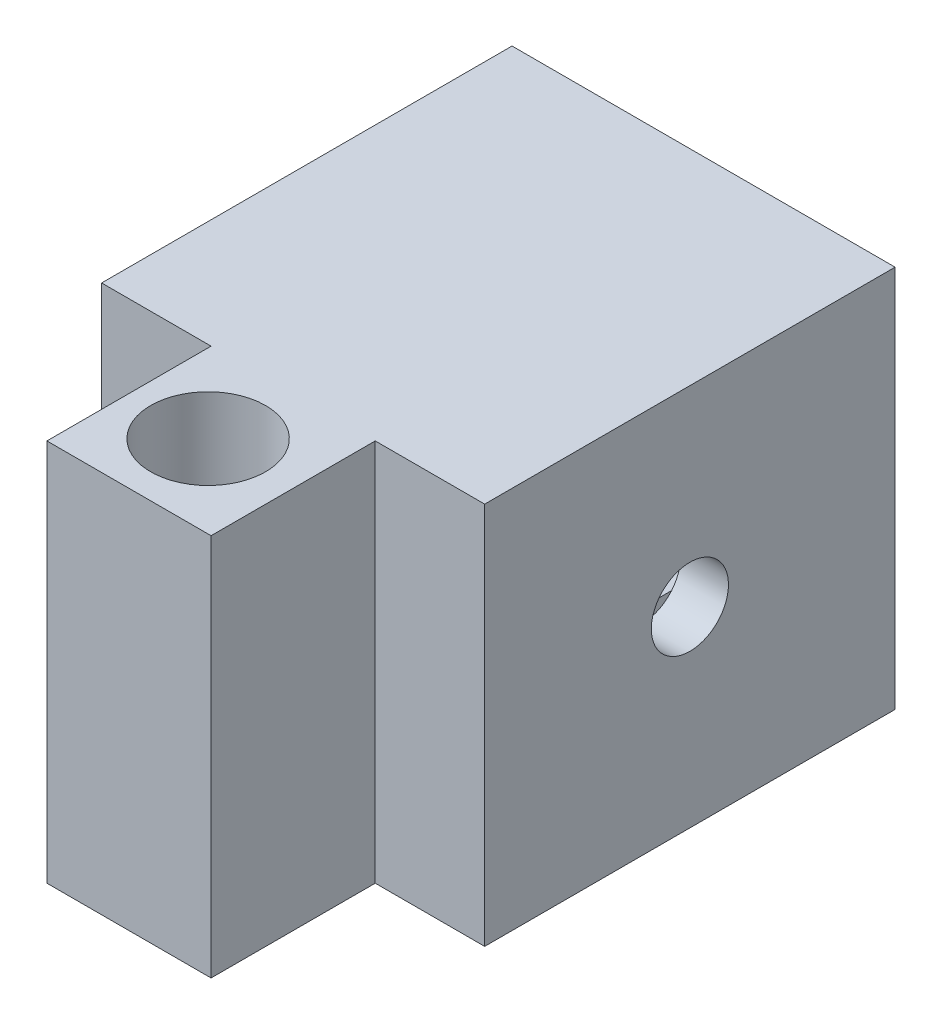
from build123d import *

# Parameters (mm, degrees)
EXTRUDE_2_DEPTH     = 30
EXTRUDE_2_2_DEPTH   = 30
EXTRUDE_3_DEPTH     = 5
SKETCH_2_5_W        = 28
SKETCH_2_5_H        = 28
EXTRUDE_4_DEPTH     = 30
SKETCH_5_R          = 2.82
CUT_EXTRUDE_1_DEPTH = 44.358966777
SKETCH_6_W          = 12
SKETCH_6_H          = 28
EXTRUDE_7_DEPTH     = 12
SKETCH_9_R          = 4.2
CUT_EXTRUDE_3_DEPTH = 44.358966777


with BuildPart() as part:
    # Эскиз2 → Бобышка-Вытянуть2 (new body)
    with BuildSketch(Plane.XY):
        Polygon((2.906720935, 8.8), (2.906720935, 10.5), (-2.993279065, 10.5), (-2.993279065, 8.8), (-4.495247842, 8.8), (-4.495247842, 7.799871607), (4.505554414, 7.799871607), (4.505554414, 8.8), align=None)
    extrude(amount=-EXTRUDE_2_DEPTH)



with BuildPart() as body_2:
    # Эскиз2 → Extrude 2 2 (new body)
    with BuildSketch(Plane.XY):
        Polygon((-2.993279065, -10.5), (2.906720935, -10.5), (2.906720935, -8.8), (4.505554414, -8.8), (4.505554414, -7.799871607), (-4.495247842, -7.799871607), (-4.495247842, -8.8), (-2.993279065, -8.8), align=None)
    extrude(amount=-EXTRUDE_2_2_DEPTH)


with BuildPart() as part_1:
    add(part.part)

    add(body_2.part)  # Бобышка-Вытянуть3 merges body 2
    # Эскиз2<4> → Бобышка-Вытянуть3 (add)
    with BuildSketch(Plane.XY):
        Polygon((10.5, -10.5), (10.5, 10.5), (2.906720935, 10.5), (2.906720935, 8.8), (4.505554414, 8.8), (4.505554414, 7.799871607), (-4.495247842, 7.799871607), (-4.495247842, 8.8), (-2.993279065, 8.8), (-2.993279065, 10.5), (-10.5, 10.5), (-10.5, -10.5), (-2.993279065, -10.5), (-2.993279065, -8.8), (-4.495247842, -8.8), (-4.495247842, -7.799871607), (4.505554414, -7.799871607), (4.505554414, -8.8), (2.906720935, -8.8), (2.906720935, -10.5), align=None)
    extrude(amount=-EXTRUDE_3_DEPTH)

    # Эскиз2<5> → Бобышка-Вытянуть4 (add)
    with BuildSketch(Plane.XY):
        Rectangle(SKETCH_2_5_W, SKETCH_2_5_H)
        Polygon((10.5, 10.5), (10.5, 0), (10.5, -10.5), (2.906720935, -10.5), (-2.993279065, -10.5), (-10.5, -10.5), (-10.5, 0), (-10.5, 10.5), (-2.993279065, 10.5), (2.906720935, 10.5), align=None, mode=Mode.SUBTRACT)
    extrude(amount=-EXTRUDE_4_DEPTH)

    # Эскиз5 → Вырез-Вытянуть1 (cut, through all)
    with BuildSketch(Plane.ZY.offset(14)):
        with Locations((-15, 0)):
            Circle(SKETCH_5_R)
    extrude(amount=-CUT_EXTRUDE_1_DEPTH, mode=Mode.SUBTRACT)

    # Эскиз6 → Бобышка-Вытянуть7 (add)
    with BuildSketch(Plane.XY):
        Rectangle(SKETCH_6_W, SKETCH_6_H)
    extrude(amount=EXTRUDE_7_DEPTH)

    # Эскиз9 → Вырез-Вытянуть3 (cut, through all)
    with BuildSketch(Plane.XZ.offset(14)):
        with Locations((-0.251999231, 5.964564793)):
            Circle(SKETCH_9_R)
    extrude(amount=-CUT_EXTRUDE_3_DEPTH, mode=Mode.SUBTRACT)


solid = part_1.part
